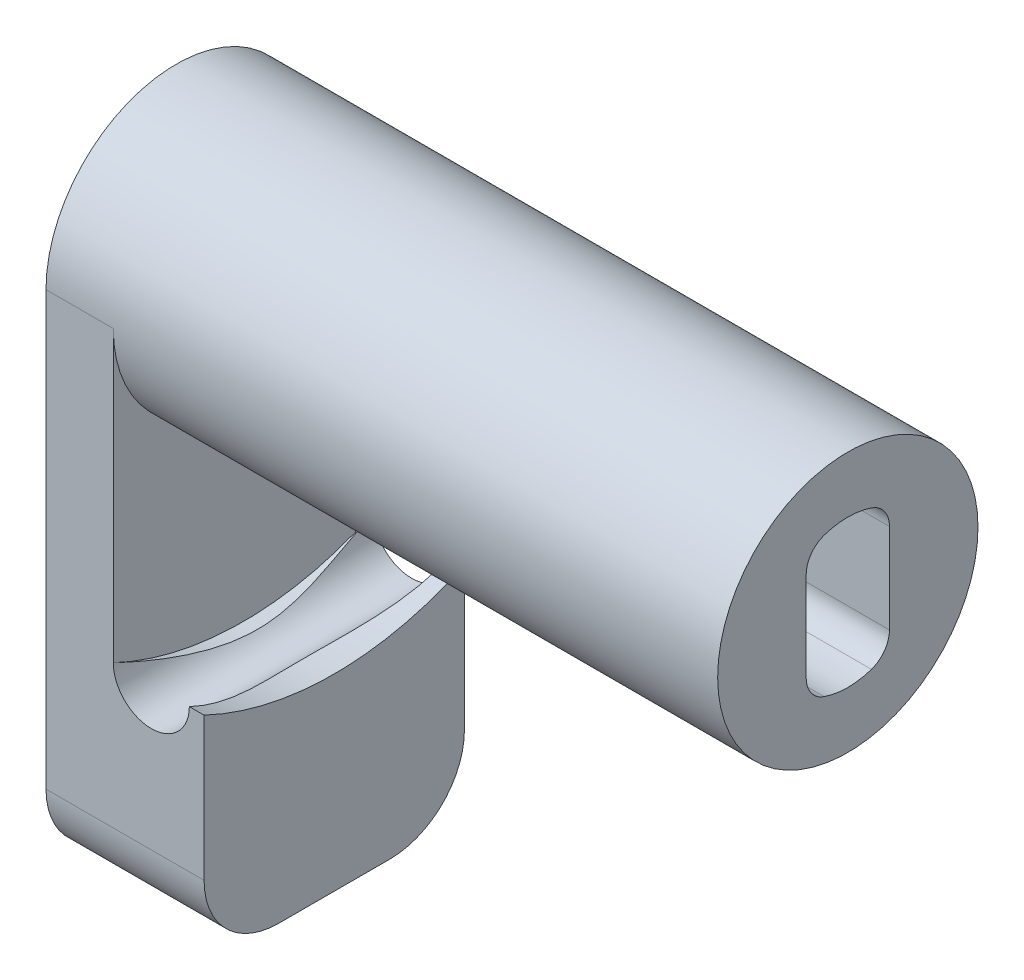
from build123d import *

# Parameters (mm, degrees)
SKETCH1_R           = 8.7376
BOSS_EXTRUDE1_DEPTH = 45.085
BOSS_EXTRUDE3_DEPTH = 4.516000112
FILLET2_R           = 5
BOSS_EXTRUDE4_START = 6.096
BOSS_EXTRUDE4_DEPTH = 6.096
CUT_EXTRUDE8_DEPTH  = 6.096
CUT_EXTRUDE10_DEPTH = 12.192
FILLET11_R          = 1.778
SKETCH25_R          = 2.5527
CUT_EXTRUDE14_DEPTH = 60.13111817
CUT_EXTRUDE15_DEPTH = 21.59
FILLET12_R          = 0.396875


with BuildPart() as part:
    # Sketch1 → Boss-Extrude1 (new body)
    with BuildSketch(Plane.YZ):
        with Locations(Location((0, 0, 0), (0, 0, 270))):
            Circle(SKETCH1_R)
    extrude(amount=BOSS_EXTRUDE1_DEPTH)

    # Sketch10 → Boss-Extrude3 (add)
    with BuildSketch(Plane(origin=(0, 0, 0), x_dir=(0, -1, 0), z_dir=(-1, 0, 0))):
        with BuildLine():
            Line((0, 8.7376), (34.036, 8.7376))
            Line((34.036, 8.7376), (34.036, -8.7376))
            Line((34.036, -8.7376), (0, -8.7376))
            ThreePointArc((0, -8.7376), (8.7376, 0), (0, 8.7376))
        make_face()
    extrude(amount=-BOSS_EXTRUDE3_DEPTH)

    # Fillet2
    fillet2_edges = [part.edges().sort_by_distance(p)[0] for p in [
        (2.258000056, -34.036, 8.7376),
        (2.258000056, -34.036, -8.7376),
    ]]
    fillet(fillet2_edges, radius=FILLET2_R)

    # Sketch15 → Boss-Extrude4 (add)
    with BuildSketch(Plane.YZ.offset(4.516000112).offset(BOSS_EXTRUDE4_START)):
        with BuildLine():
            Line((-18.796, 8.7376), (-29.036, 8.7376))
            ThreePointArc((-29.036, 8.7376), (-32.571533906, 7.273133906), (-34.036, 3.7376))
            Line((-34.036, 3.7376), (-34.036, -3.7376))
            ThreePointArc((-34.036, -3.7376), (-32.571533906, -7.273133906), (-29.036, -8.7376))
            Line((-29.036, -8.7376), (-18.796, -8.7376))
            Line((-18.796, -8.7376), (-18.796, 8.7376))
        make_face()
    extrude(amount=-BOSS_EXTRUDE4_DEPTH)

    # Sketch21 → Cut-Extrude8 (cut)
    with BuildSketch(Plane.YZ.offset(10.612000112)):
        with BuildLine():
            Line((-19.431, -8.7376), (-18.796, -8.7376))
            Line((-18.796, -8.7376), (-18.796, 8.7376))
            Line((-18.796, 8.7376), (-19.431, 8.7376))
            ThreePointArc((-19.431, 8.7376), (-21.405517007, 0), (-19.431, -8.7376))
        make_face()
    extrude(amount=-CUT_EXTRUDE8_DEPTH, mode=Mode.SUBTRACT)

    # Sketch22 → Cut-Extrude10 (cut)
    with BuildSketch(Plane.YZ.offset(45.085)):
        with BuildLine():
            Line((-4.089715516, -2.794), (4.089715516, -2.794))
            ThreePointArc((4.089715516, -2.794), (4.953, 0), (4.089715516, 2.794))
            Line((4.089715516, 2.794), (-4.089715516, 2.794))
            ThreePointArc((-4.089715516, 2.794), (-4.953, 0), (-4.089715516, -2.794))
        make_face()
    extrude(amount=-CUT_EXTRUDE10_DEPTH, mode=Mode.SUBTRACT)

    # Fillet11
    fillet11_edges = [part.edges().sort_by_distance(p)[0] for p in [
        (38.989, 4.089715516, 2.794),
        (38.989, 4.089715516, -2.794),
        (38.989, -4.089715516, -2.794),
        (38.989, -4.089715516, 2.794),
    ]]
    fillet(fillet11_edges, radius=FILLET11_R)

    # Sketch25 → Cut-Extrude14 (cut, through all)
    with BuildSketch(Plane(origin=(0, 0, -8.7376), x_dir=(1, 0, 0), z_dir=(0, 0, -1))):
        with Locations((7.068700112, 19.431)):
            Circle(SKETCH25_R)
    extrude(amount=-CUT_EXTRUDE14_DEPTH, mode=Mode.SUBTRACT)

    # Sketch26 → Cut-Extrude15 (cut)
    with BuildSketch(Plane(origin=(0, 0, 0), x_dir=(0, -1, 0), z_dir=(-1, 0, 0))):
        with BuildLine():
            Line((3.684641875, 1.7145), (5.589641875, 1.7145))
            Line((5.589641875, 1.7145), (5.589641875, -1.7145))
            Line((5.589641875, -1.7145), (3.684641875, -1.7145))
            ThreePointArc((3.684641875, -1.7145), (-4.064, 0), (3.684641875, 1.7145))
        make_face()
    extrude(amount=-CUT_EXTRUDE15_DEPTH, mode=Mode.SUBTRACT)

    # Fillet12
    fillet12_edges = [part.edges().sort_by_distance(p)[0] for p in [
        (10.795, -3.684641875, -1.7145),
        (10.795, -3.684641875, 1.7145),
        (10.795, -5.589641875, 1.7145),
        (10.795, -5.589641875, -1.7145),
    ]]
    fillet(fillet12_edges, radius=FILLET12_R)


solid = part.part
